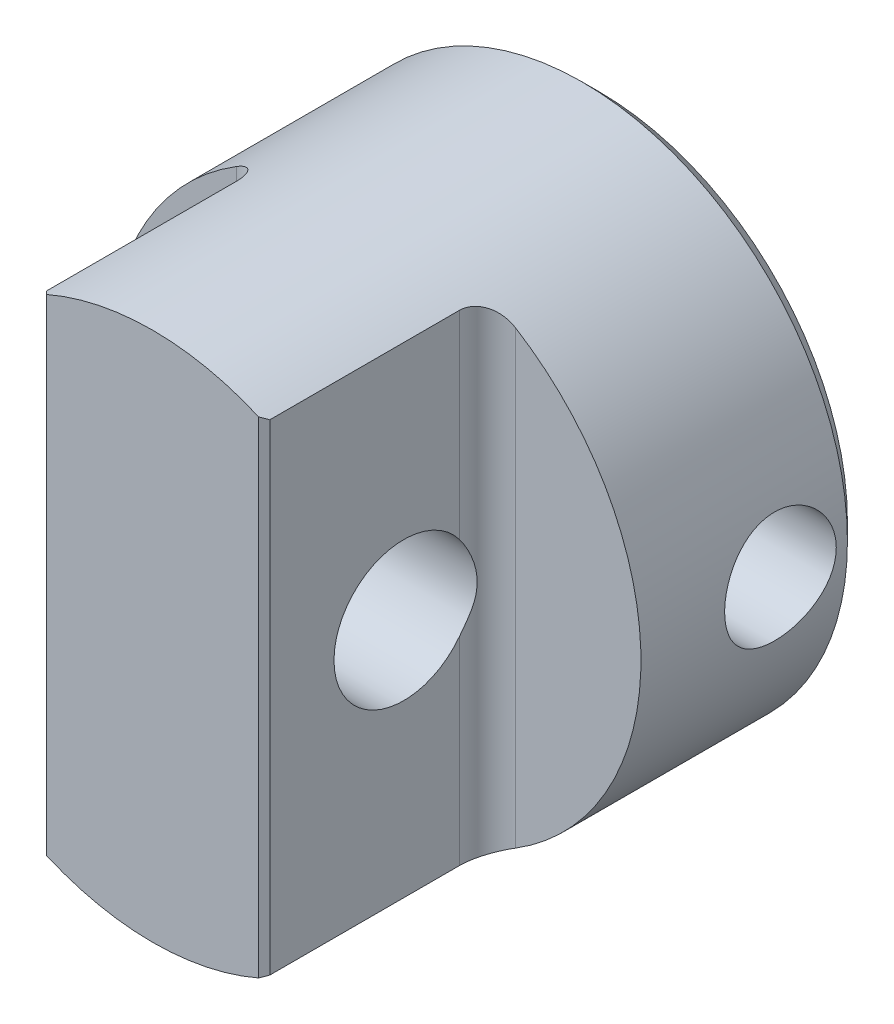
from build123d import *

# Parameters (mm, degrees)
SKETCH_1_R               = 47.5
EXTRUDE_1_DEPTH          = 80
CUT_EXTRUDE_START        = -40
CUT_EXTRUDE_1_DEPTH      = 40
FILLET_1_R               = 5
SKETCH_3_R               = 12.5
CUT_EXTRUDE_2_DEPTH      = 115.945639495
CHAMFER_1_SIZE           = 1
CHAMFER_2_SIZE           = 3
CUT_EXTRUDE_3_DEPTH      = 105.462912246
CUT_EXTRUDE_3_DEPTH_BACK = 105.462912246
SKETCH_4_R               = 10


with BuildPart() as part:
    # Эскиз1 → Бобышка-Вытянуть1 (new body)
    with BuildSketch(Plane.XY):
        Circle(SKETCH_1_R)
    extrude(amount=EXTRUDE_1_DEPTH)

    # Эскиз2 → Вырез-Вытянуть1 (cut)
    with BuildSketch(Plane.XY.offset(80).offset(CUT_EXTRUDE_START)):
        with BuildLine():
            Line((20, -43.084219849), (20, 43.084219849))
            ThreePointArc((20, 43.084219849), (47.5, 0), (20, -43.084219849))
        make_face()
        with BuildLine():
            Line((-20, -43.084219849), (-20, 43.084219849))
            ThreePointArc((-20, 43.084219849), (-47.5, 0), (-20, -43.084219849))
        make_face()
    extrude(amount=CUT_EXTRUDE_1_DEPTH, mode=Mode.SUBTRACT)

    # Скругление1
    fillet_1_edges = [part.edges().sort_by_distance(p)[0] for p in [
        (-20, 0, 40),
        (20, 0, 40),
    ]]
    fillet(fillet_1_edges, radius=FILLET_1_R)

    # Эскиз3 → Вырез-Вытянуть2 (cut, through all)
    with BuildSketch(Plane.ZY.offset(20)):
        with Locations(Location((55, 0, 0), (0, 0, 216.869897646))):
            Circle(SKETCH_3_R)
    extrude(amount=-CUT_EXTRUDE_2_DEPTH, mode=Mode.SUBTRACT)

    # Фаска1
    chamfer_1_edges = [part.edges().sort_by_distance(p)[0] for p in [
        (-20, 0, 80),
        (20, 0, 80),
    ]]
    chamfer(chamfer_1_edges, length=CHAMFER_1_SIZE)

    # Фаска2
    chamfer_2_edges = [part.edges().sort_by_distance(p)[0] for p in [
        (-47.5, 0, 0),
    ]]
    chamfer(chamfer_2_edges, length=CHAMFER_2_SIZE)

    # Эскиз4 → Вырез-Вытянуть3 (cut, two sides: drawn at the far end of the back side and taken through both)
    with BuildSketch(Plane(origin=(0, 0, 0), x_dir=(0, 0, -1), z_dir=(1, 0, 0)).offset(-CUT_EXTRUDE_3_DEPTH_BACK)):
        with Locations((-15, 0)):
            Circle(SKETCH_4_R)
    extrude(amount=CUT_EXTRUDE_3_DEPTH + CUT_EXTRUDE_3_DEPTH_BACK, mode=Mode.SUBTRACT)


solid = part.part
